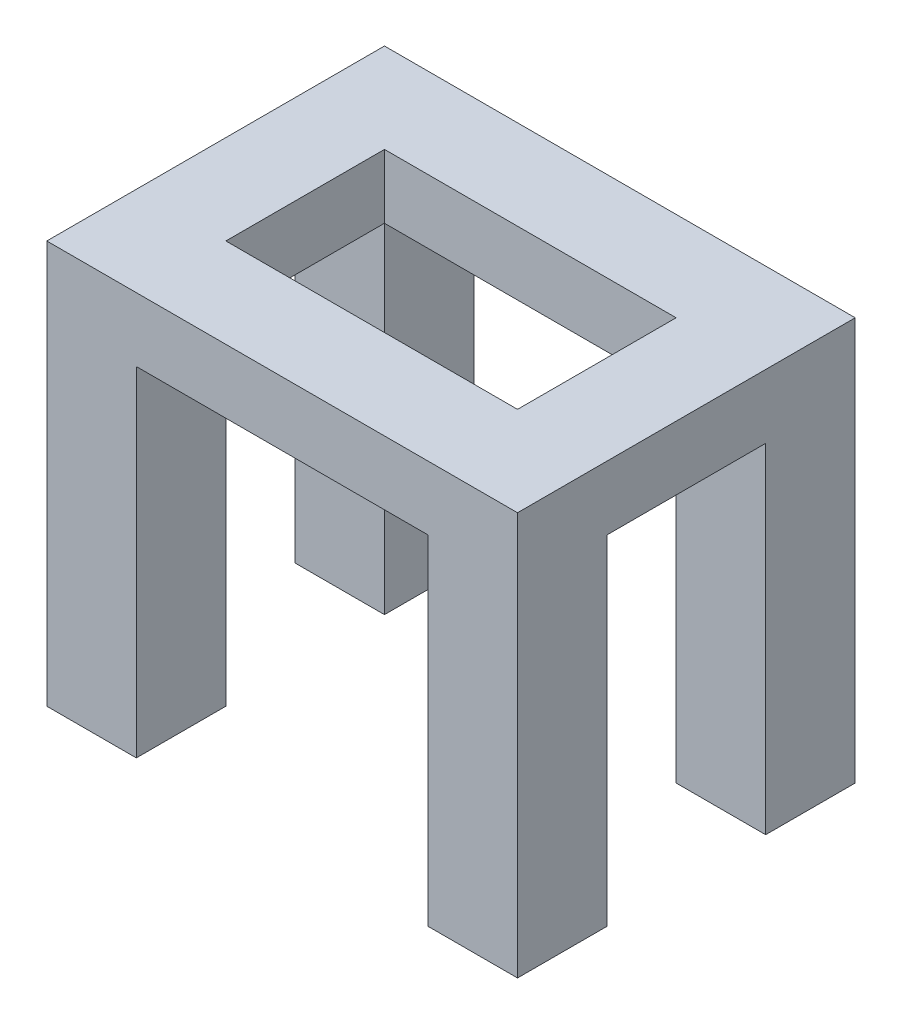
from build123d import *

# Parameters (mm, degrees)
SKETCH1_W           = 36.8
SKETCH1_H           = 26.4
SKETCH1_W_2         = 22.8
SKETCH1_H_2         = 12.4
BOSS_EXTRUDE1_DEPTH = 5
SKETCH2_W           = 7
SKETCH2_H           = 7
BOSS_EXTRUDE2_DEPTH = 26.5


with BuildPart() as part:
    # Sketch1 → Boss-Extrude1 (new body)
    with BuildSketch(Plane(origin=(0, 0, 0), x_dir=(1, 0, 0), z_dir=(0, 1, 0))):
        with Locations((1.98028169, 1.052112676)):
            Rectangle(SKETCH1_W, SKETCH1_H)
        with Locations((1.98028169, 1.052112676)):
            Rectangle(SKETCH1_W_2, SKETCH1_H_2, mode=Mode.SUBTRACT)
    extrude(amount=BOSS_EXTRUDE1_DEPTH)

    # Sketch2 → Boss-Extrude2 (add)
    with BuildSketch(Plane.XZ):
        with Locations((16.88028169, -10.752112676)):
            Rectangle(SKETCH2_W, SKETCH2_H)
        with Locations((-12.91971831, -10.752112676)):
            Rectangle(SKETCH2_W, SKETCH2_H)
        with Locations((-12.91971831, 8.647887324)):
            Rectangle(SKETCH2_W, SKETCH2_H)
        with Locations((16.88028169, 8.647887324)):
            Rectangle(SKETCH2_W, SKETCH2_H)
    extrude(amount=BOSS_EXTRUDE2_DEPTH)


solid = part.part
